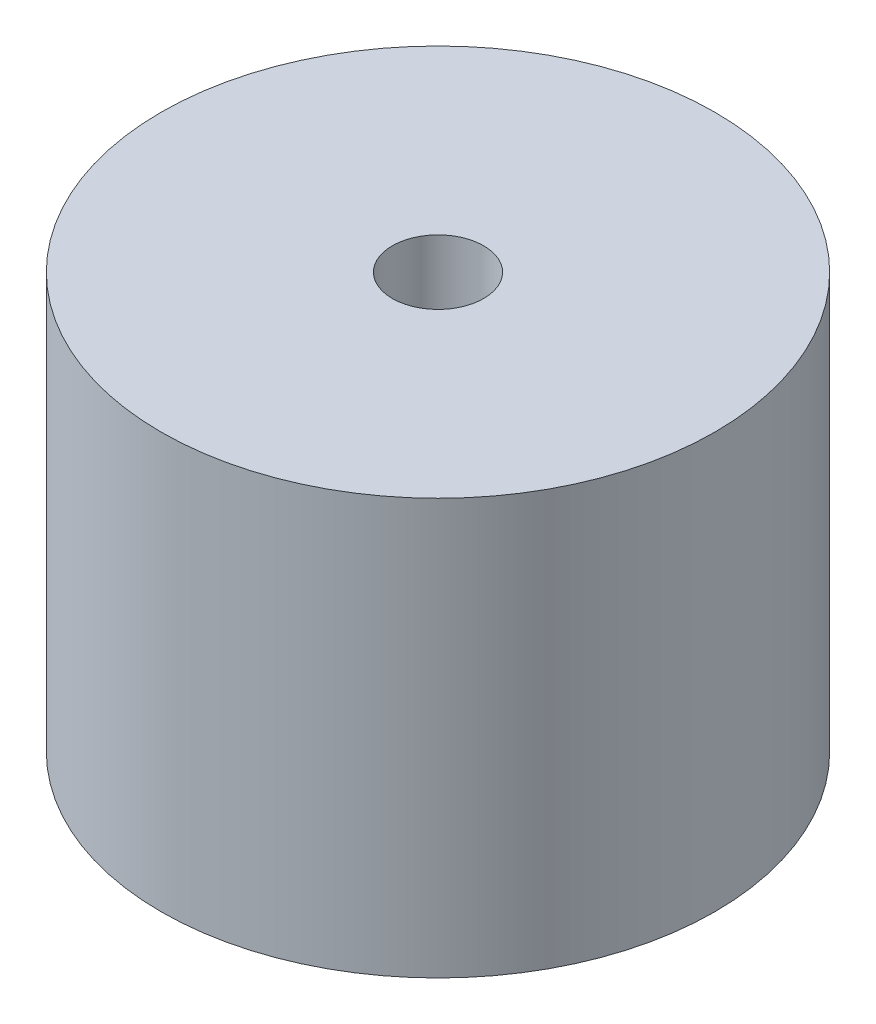
from build123d import *

# Parameters (mm, degrees)
SZKIC1_R                    = 10
DODANIE_WYCI_GNI_CIE1_DEPTH = 15
OTW_R_GWINTOWANY_M41_D      = 3.3
OTW_R_GWINTOWANY_M41_DEPTH  = 5
OTW_R_GWINTOWANY_M41_TIP    = 0.991420021


with BuildPart() as part:
    # Szkic1 → Dodanie-wyciągnięcie1 (new body)
    with BuildSketch(Plane(origin=(0, 0, 0), x_dir=(1, 0, 0), z_dir=(0, 1, 0))):
        with Locations(Location((0, 0, 0), (0, 0, 270))):
            Circle(SZKIC1_R)
    extrude(amount=DODANIE_WYCI_GNI_CIE1_DEPTH)

    # Otwór gwintowany M41
    with Locations(Plane(origin=(0, 15, 0), x_dir=(1, 0, 0), z_dir=(0, 1, 0))):
        with Locations((0, 0)):
            Hole(OTW_R_GWINTOWANY_M41_D / 2, depth=OTW_R_GWINTOWANY_M41_DEPTH)
            with Locations((0, 0, -(OTW_R_GWINTOWANY_M41_DEPTH + OTW_R_GWINTOWANY_M41_TIP / 2))):  # 118° drill point
                Cone(0, OTW_R_GWINTOWANY_M41_D / 2, OTW_R_GWINTOWANY_M41_TIP, mode=Mode.SUBTRACT)


solid = part.part
